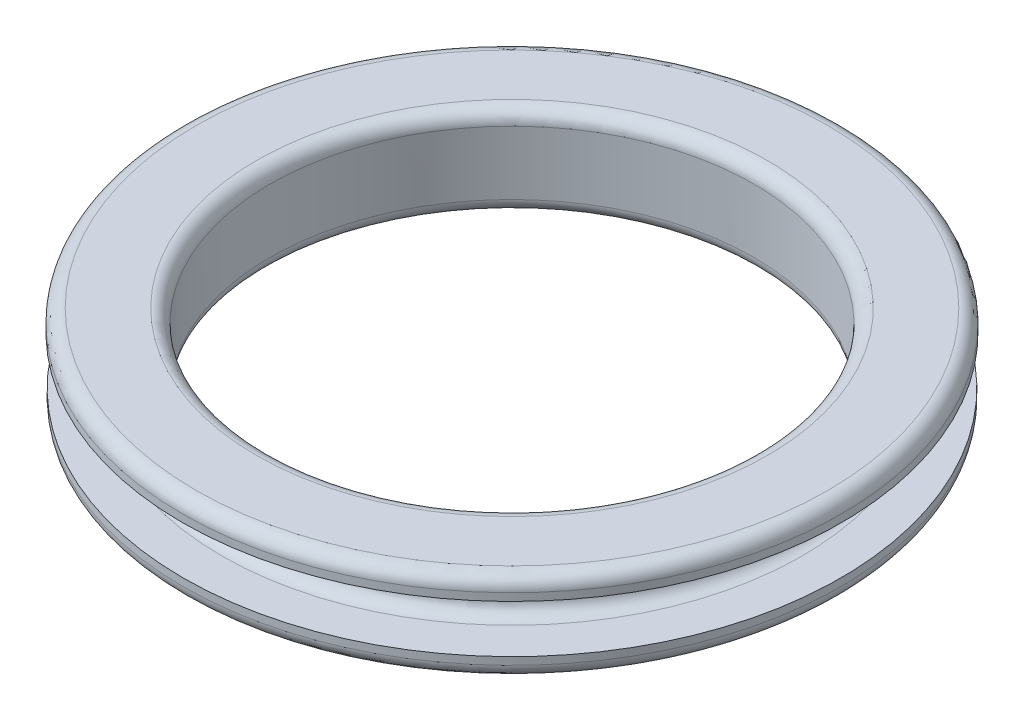
from build123d import *

# Parameters (mm, degrees)
FILLET1_R = 0.45


with BuildPart() as part:
    # Sketch1 → Revolve1 (revolve)
    with BuildSketch(Plane.XY, mode=Mode.PRIVATE) as revolve1_sk:
        Polygon((-8, 0), (-8, 3), (-10.9, 3), (-10.9, 2.3), (-9.153413472, 2.3), (-9.153413472, 0.7), (-10.87175241, 0.7), (-10.87175241, 0), align=None)
    revolve(revolve1_sk.sketch.rotate(Axis((0, 7.246866229, 0), (0, -1, 0)), 270), axis=Axis((0, 7.246866229, 0), (0, -1, 0)))

    # Fillet1
    fillet1_edges = [part.edges().sort_by_distance(p)[0] for p in [
        (0, 0, -10.87175241),
        (0, 0.7, -9.153413472),
        (0, 2.3, -9.153413472),
        (0, 3, -10.9),
        (0, 3, -8),
        (0, 0, -8),
    ]]
    fillet(fillet1_edges, radius=FILLET1_R)


solid = part.part
